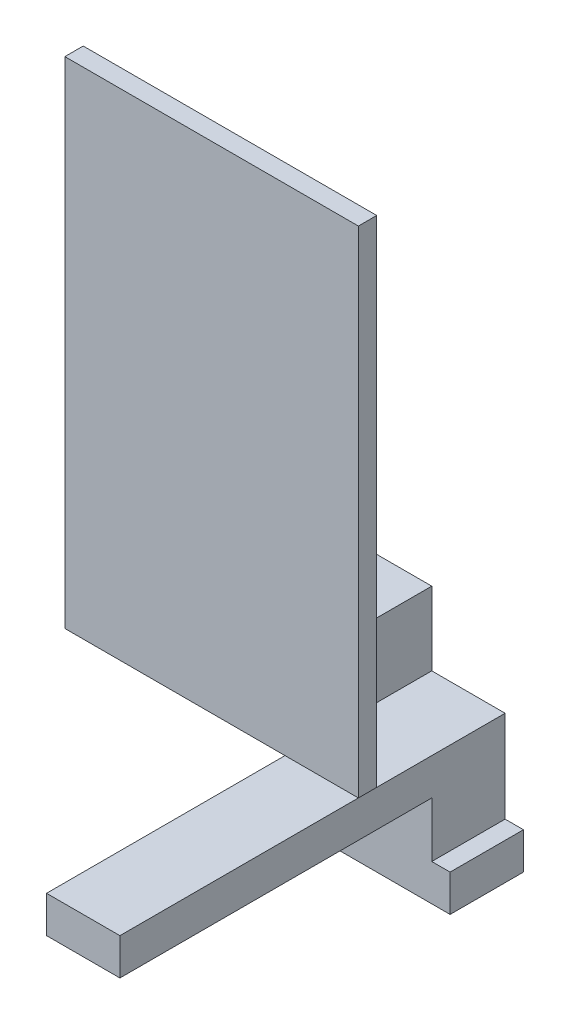
from build123d import *

# Parameters (mm, degrees)
BOSS_EXTRUDE1_DEPTH = 20
BOSS_EXTRUDE2_DEPTH = 20
SKETCH3_W           = 20
SKETCH3_H           = 10
BOSS_EXTRUDE3_DEPTH = 85
SKETCH6_W           = 80
SKETCH6_H           = 85
BOSS_EXTRUDE4_DEPTH = 25
SKETCH7_W           = 30
SKETCH7_H           = 20
CUT_EXTRUDE1_DEPTH  = 70
CUT_EXTRUDE2_DEPTH  = 20
SKETCH9_W           = 80
SKETCH9_H           = 5
BOSS_EXTRUDE5_DEPTH = 50


with BuildPart() as part:
    # Sketch1 → Boss-Extrude1 (new body)
    with BuildSketch(Plane.XY):
        Polygon((10, 0), (-10, 0), (-10, -15), (-15, -15), (-15, -25), (15, -25), (15, -15), (10, -15), align=None)
    extrude(amount=BOSS_EXTRUDE1_DEPTH)

    # Sketch2 → Boss-Extrude2 (add)
    with BuildSketch(Plane(origin=(0, 0, 0), x_dir=(-1, 0, 0), z_dir=(0, 0, -1))):
        Polygon((10, 0), (40, 0), (40, 100), (10, 100), (10, 10), (-10, 10), (-10, 0), align=None)
    extrude(amount=-BOSS_EXTRUDE2_DEPTH)

    # Sketch3 → Boss-Extrude3 (add)
    with BuildSketch(Plane.XY.offset(20)):
        with Locations((0, 5)):
            Rectangle(SKETCH3_W, SKETCH3_H)
    extrude(amount=BOSS_EXTRUDE3_DEPTH)

    # Sketch6 → Boss-Extrude4 (add)
    with BuildSketch(Plane.XY.offset(20)):
        with Locations((-25, 57.5)):
            Rectangle(SKETCH6_W, SKETCH6_H)
    extrude(amount=BOSS_EXTRUDE4_DEPTH)

    # Sketch7 → Cut-Extrude1 (cut)
    with BuildSketch(Plane(origin=(0, 100, 0), x_dir=(1, 0, 0), z_dir=(0, 1, 0))):
        with Locations((-25, -10)):
            Rectangle(SKETCH7_W, SKETCH7_H)
    extrude(amount=-CUT_EXTRUDE1_DEPTH, mode=Mode.SUBTRACT)

    # Sketch8 → Cut-Extrude2 (cut)
    with BuildSketch(Plane(origin=(0, 0, 20), x_dir=(-1, 0, 0), z_dir=(0, 0, -1))):
        Polygon((40, 30), (40, 15), (65, 15), (65, 100), (-15, 100), (-15, 15), (10, 15), (10, 30), align=None)
    extrude(amount=-CUT_EXTRUDE2_DEPTH, mode=Mode.SUBTRACT)

    # Sketch9 → Boss-Extrude5 (add)
    with BuildSketch(Plane(origin=(0, 100, 0), x_dir=(1, 0, 0), z_dir=(0, 1, 0))):
        with Locations((-25, -42.5)):
            Rectangle(SKETCH9_W, SKETCH9_H)
    extrude(amount=BOSS_EXTRUDE5_DEPTH)


solid = part.part
